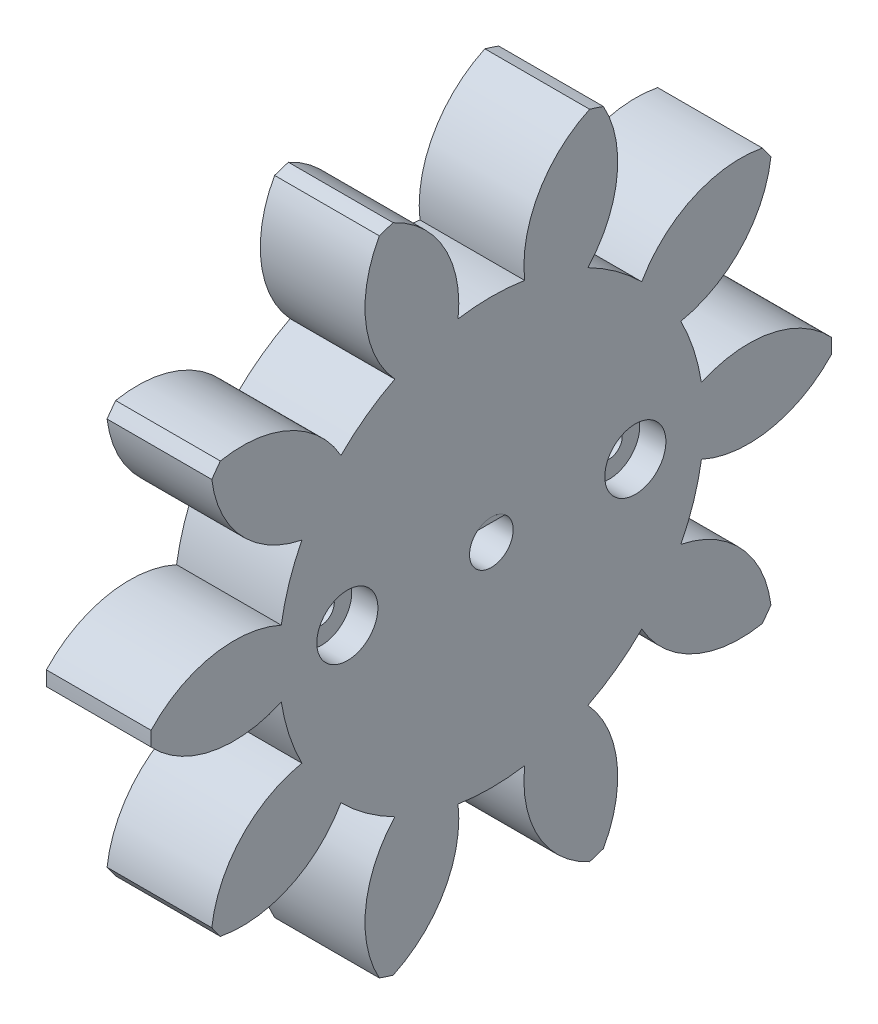
from build123d import *

# Parameters (mm, degrees)
BASPROSKE_W             = 12
BASPROSKE_H             = 39
TOOTHCUT_DEPTH          = 57.444663167
TEETHCUTS_COUNT         = 10
BORSKE_R                = 1.5
BORE_DEPTH              = 12
CROQUIS1_R              = 2.5
CORTAR_EXTRUIR1_DEPTH   = 56.31066802
SALIENTE_EXTRUIR1_DEPTH = 12
CROQUIS3_R              = 1.5
CORTAR_EXTRUIR2_DEPTH   = 12
CROQUIS3_3_R            = 3.5
CROQUIS3_3_R_2          = 1.5
CORTAR_EXTRUIR3_DEPTH   = 3


with BuildPart() as part:
    # BasProSke → Base-Revolve (revolve)
    with BuildSketch(Plane(origin=(0, 0, 0), x_dir=(1, 0, 0), z_dir=(0, 1, 0)), mode=Mode.PRIVATE) as base_revolve_sk:
        with Locations((6, 19.5)):
            Rectangle(BASPROSKE_W, BASPROSKE_H)
    revolve(base_revolve_sk.sketch.rotate(Axis((-10, 0, 0), (1, 0, 0)), 180), axis=Axis((-10, 0, 0), (1, 0, 0)))

    # TooCutSke → ToothCut (cut, through all)
    with BuildSketch(Plane(origin=(0, 0, 0), x_dir=(0, 0, -1), z_dir=(1, 0, 0))):
        with BuildLine():
            ThreePointArc((3.815775932, 24.073465269), (0, 24.374), (-3.815775932, 24.073465269))
            ThreePointArc((-3.815775932, 24.073465269), (-5.403120307, 31.925375456), (-11.292153099, 37.355978418))
            ThreePointArc((-11.292153099, 37.355978418), (0, 39.0254), (11.292153099, 37.355978418))
            ThreePointArc((11.292153099, 37.355978418), (5.403120307, 31.925375456), (3.815775932, 24.073465269))
        make_face()
    toothcut = extrude(amount=TOOTHCUT_DEPTH, mode=Mode.SUBTRACT)

    # TeethCuts: ToothCut ×10 about axis
    teethcuts_axis = Axis((0, 0, 0), (1, 0, 0))
    for i in range(1, TEETHCUTS_COUNT):
        add(toothcut.rotate(teethcuts_axis, i * 360 / TEETHCUTS_COUNT), mode=Mode.SUBTRACT)

    # BorSke → Bore (cut, symmetric)
    with BuildSketch(Plane(origin=(0, 0, 0), x_dir=(0, 0, -1), z_dir=(1, 0, 0))):
        with Locations(Location((0, 0, 0), (0, 0, 180))):
            Circle(BORSKE_R)
    extrude(amount=BORE_DEPTH, both=True, mode=Mode.SUBTRACT)

    # Croquis1 → Cortar-Extruir1 (cut, through all)
    with BuildSketch(Plane.YZ.offset(12)):
        with Locations(Location((0, 0, 0), (0, 0, 270))):
            Circle(CROQUIS1_R)
    extrude(amount=-CORTAR_EXTRUIR1_DEPTH, mode=Mode.SUBTRACT)

    # Croquis3 → Cortar-Extruir2 (cut)
    with BuildSketch(Plane(origin=(12, 0, 0), x_dir=(0, 0, -1), z_dir=(1, 0, 0))):
        with Locations((-16.5, 0)):
            Circle(CROQUIS3_R)
    cortar_extruir2 = extrude(amount=-CORTAR_EXTRUIR2_DEPTH, mode=Mode.SUBTRACT)

    # Croquis3<3> → Cortar-Extruir3 (cut)
    with BuildSketch(Plane(origin=(12, 0, 0), x_dir=(0, 0, -1), z_dir=(1, 0, 0))):
        with Locations((-16.5, 0)):
            Circle(CROQUIS3_3_R)
        with Locations((-16.5, 0)):
            Circle(CROQUIS3_3_R_2, mode=Mode.SUBTRACT)
    cortar_extruir3 = extrude(amount=-CORTAR_EXTRUIR3_DEPTH, mode=Mode.SUBTRACT)

    # Simetría1: Cortar-Extruir2, Cortar-Extruir3 across plane
    add(cortar_extruir2.mirror(Plane.XY), mode=Mode.SUBTRACT)
    add(cortar_extruir3.mirror(Plane.XY), mode=Mode.SUBTRACT)


with BuildPart() as body_2:
    # Croquis2 → Saliente-Extruir1 (new body)
    with BuildSketch(Plane(origin=(12, 0, 0), x_dir=(0, 0, -1), z_dir=(1, 0, 0))):
        with BuildLine():
            ThreePointArc((1.564448785, 1.95), (0, 2.5), (-1.564448785, 1.95))
            Line((-1.564448785, 1.95), (1.564448785, 1.95))
        make_face()
    extrude(amount=-SALIENTE_EXTRUIR1_DEPTH)


solid = Compound([part.part, body_2.part])
